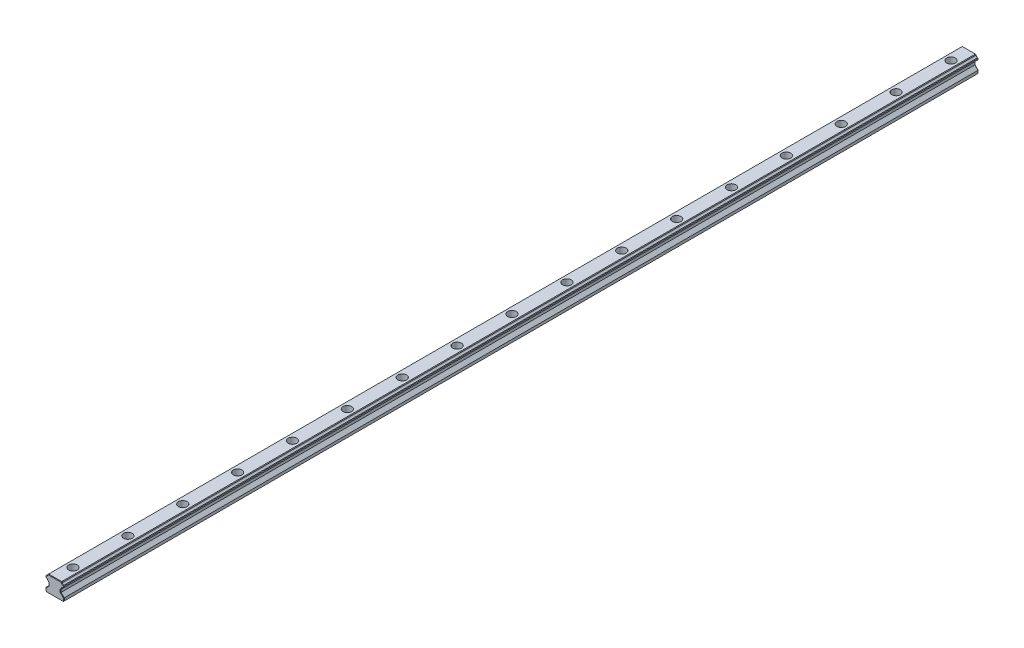
from build123d import *

# Parameters (mm, degrees)
BOSS_EXTRUDE1_DEPTH      = 500
BOSS_EXTRUDE1_DEPTH_BACK = 500
LPATTERN2_COUNT          = 17
LPATTERN2_PITCH          = 60
CHAMFER1_SIZE            = 0.5


with BuildPart() as part:
    # Sketch3 → Boss-Extrude1 (new, two sides: drawn at the far end of the back side and taken through both)
    with BuildSketch(Plane.XY.offset(-BOSS_EXTRUDE1_DEPTH_BACK)):
        with BuildLine():
            Line((3, 9), (-3, 9))
            Line((-3, 9), (-7.160036564, 9))
            Line((-7.160036564, 9), (-7.767930373, 8.392105714))
            ThreePointArc((-7.767930373, 8.392105714), (-8.344874488, 7.264307267), (-9.472673258, 6.687363783))
            Line((-9.472673258, 6.687363783), (-10, 6.160037041))
            Line((-10, 6.160037041), (-10, 4.82918644))
            Line((-10, 4.82918644), (-9.472673258, 4.314376637))
            ThreePointArc((-9.472673258, 4.314376637), (-8.341068744, 3.731631743), (-7.767930373, 2.595131504))
            Line((-7.767930373, 2.595131504), (-6.550048828, 1.379235268))
            Line((-6.550048828, 1.379235268), (-6.550048828, -1.550048828))
            Line((-6.550048828, -1.550048828), (-10, -4.999922752))
            Line((-10, -4.999922752), (-10, -8))
            Line((-10, -8), (-9, -9))
            Line((-9, -9), (0, -9))
            Line((0, -9), (9, -9))
            Line((9, -9), (10, -8))
            Line((10, -8), (10, -4.999922752))
            Line((10, -4.999922752), (6.550048828, -1.550048828))
            Line((6.550048828, -1.550048828), (6.550048828, 1.379235268))
            Line((6.550048828, 1.379235268), (7.767930373, 2.595131504))
            ThreePointArc((7.767930373, 2.595131504), (8.341068744, 3.731631743), (9.472673258, 4.314376637))
            Line((9.472673258, 4.314376637), (10, 4.82918644))
            Line((10, 4.82918644), (10, 6.160037041))
            Line((10, 6.160037041), (9.472673258, 6.687363783))
            ThreePointArc((9.472673258, 6.687363783), (8.344874488, 7.264307267), (7.767930373, 8.392105714))
            Line((7.767930373, 8.392105714), (7.160036564, 9))
            Line((7.160036564, 9), (3, 9))
        make_face()
    extrude(amount=BOSS_EXTRUDE1_DEPTH + BOSS_EXTRUDE1_DEPTH_BACK)

    # Sketch4 → Cut-Revolve1 (revolve, cut)
    with BuildSketch(Plane(origin=(0, 0, 0), x_dir=(0, 0, -1), z_dir=(1, 0, 0)), mode=Mode.PRIVATE) as cut_revolve1_sk:
        Polygon((-475.25, 9), (-480, 9), (-480, -9), (-477, -9), (-477, 0.5), (-475.25, 0.5), align=None)
    cut_revolve1 = revolve(cut_revolve1_sk.sketch.rotate(Axis((0, 9, 480), (0, -1, 0)), 180), axis=Axis((0, 9, 480), (0, -1, 0)), mode=Mode.SUBTRACT)

    # LPattern2: Cut-Revolve1 ×17
    with Locations(*[(0, 0, -i * LPATTERN2_PITCH) for i in range(1, LPATTERN2_COUNT)]):
        add(cut_revolve1, mode=Mode.SUBTRACT)

    # Chamfer1
    chamfer1_edges = [part.edges().sort_by_distance(p)[0] for p in [
        (-6.550048828, -0.08540678, 500),
        (-8.275024414, -3.27498579, 500),
        (-10, -6.499961376, 500),
        (-9.5, -8.5, 500),
        (0, -9, 500),
        (9.5, -8.5, 500),
        (10, -6.499961376, 500),
        (8.275024414, -3.27498579, 500),
        (6.550048828, -0.08540678, 500),
        (-8.341068744, 3.731631743, 500),
        (7.158989601, 1.987183386, 500),
        (8.341068744, 3.731631743, 500),
        (9.736336629, 4.571781538, 500),
        (-9.736336629, 4.571781538, -500),
        (-10, 5.49461174, -500),
        (10, 5.49461174, 500),
        (-9.736336629, 6.423700412, -500),
        (-7.463983469, 8.696052857, -500),
        (0, 9, -500),
        (7.463983469, 8.696052857, -500),
        (9.736336629, 6.423700412, -500),
        (10, 5.49461174, -500),
        (9.736336629, 6.423700412, 500),
        (9.736336629, 4.571781538, -500),
        (7.158989601, 1.987183386, -500),
        (6.550048828, -0.08540678, -500),
        (8.275024414, -3.27498579, -500),
        (10, -6.499961376, -500),
        (9.5, -8.5, -500),
        (0, -9, -500),
        (8.344874488, 7.264307267, 500),
        (-9.5, -8.5, -500),
        (-10, -6.499961376, -500),
        (-8.275024414, -3.27498579, -500),
        (-6.550048828, -0.08540678, -500),
        (-7.158989601, 1.987183386, -500),
        (-8.341068744, 3.731631743, -500),
        (-8.344874488, 7.264307267, -500),
        (8.344874488, 7.264307267, -500),
        (8.341068744, 3.731631743, -500),
        (7.463983469, 8.696052857, 500),
        (0, 9, 500),
        (-7.463983469, 8.696052857, 500),
        (-8.344874488, 7.264307267, 500),
        (-7.158989601, 1.987183386, 500),
        (-9.736336629, 6.423700412, 500),
        (-10, 5.49461174, 500),
        (-9.736336629, 4.571781538, 500),
    ]]
    chamfer(chamfer1_edges, length=CHAMFER1_SIZE)


solid = part.part
